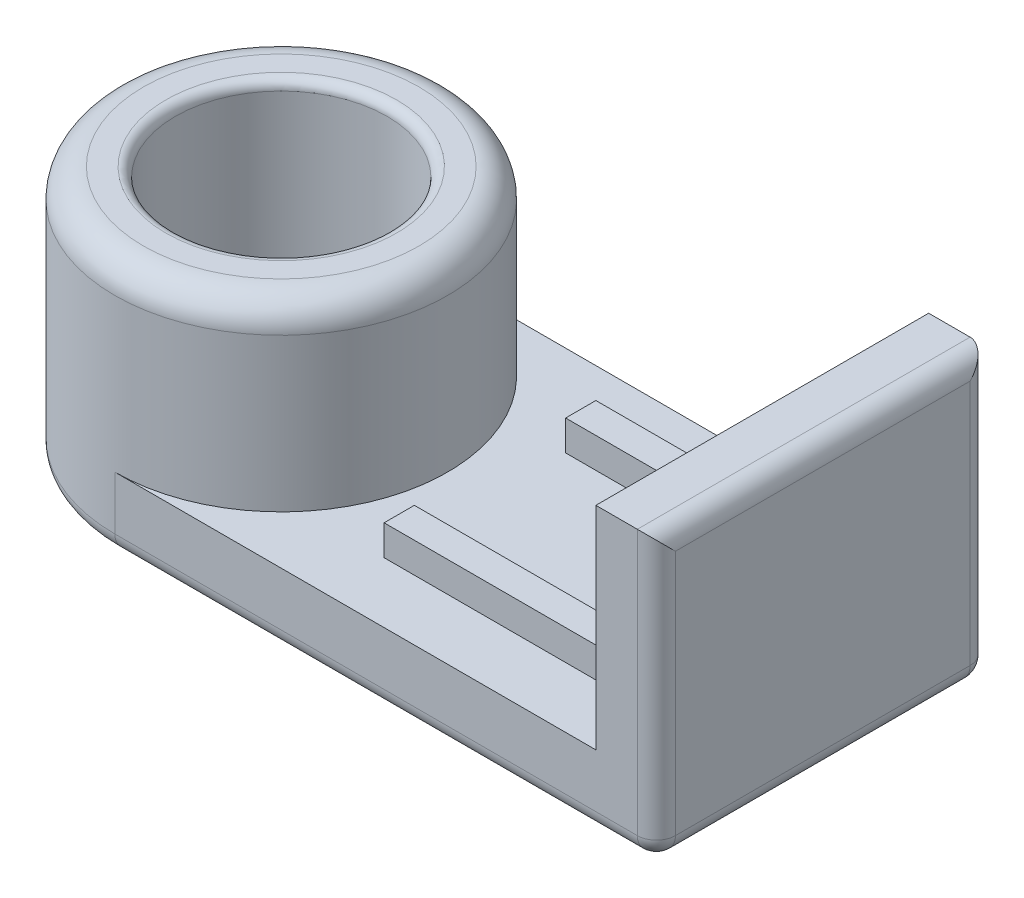
from build123d import *

# Parameters (mm, degrees)
BOSS_EXTRUDE1_DEPTH = 7.62
SKETCH4_W           = 6.35
SKETCH4_H           = 34.925
BOSS_EXTRUDE3_DEPTH = 12.7
SKETCH5_R           = 11.1125
CUT_EXTRUDE1_DEPTH  = 12.7
SKETCH6_W           = 25.4
SKETCH6_H           = 3.175
BOSS_EXTRUDE4_DEPTH = 3.175
SKETCH7_W           = 25.4
SKETCH7_H           = 3.175
BOSS_EXTRUDE5_DEPTH = 3.175
SKETCH10_W          = 6.35
SKETCH10_H          = 34.925
BOSS_EXTRUDE8_DEPTH = 9.525
FILLET1_R           = 2
FILLET2_R           = 2
SKETCH11_R          = 17.4625
BOSS_EXTRUDE9_DEPTH = 19.05
SKETCH12_R          = 11.1125
CUT_EXTRUDE2_DEPTH  = 47.677899348
FILLET3_R           = 1
FILLET4_R           = 3


with BuildPart() as part:
    # Sketch1 → Boss-Extrude1 (new body)
    with BuildSketch(Plane(origin=(0, 0, 0), x_dir=(1, 0, 0), z_dir=(0, 1, 0))):
        with BuildLine():
            Line((37.1475, -17.4625), (37.1475, 17.4625))
            Line((37.1475, 17.4625), (-19.685, 17.4625))
            ThreePointArc((-19.685, 17.4625), (-37.1475, 0), (-19.685, -17.4625))
            Line((-19.685, -17.4625), (37.1475, -17.4625))
        make_face()
    extrude(amount=BOSS_EXTRUDE1_DEPTH)

    # Sketch4 → Boss-Extrude3 (add)
    with BuildSketch(Plane(origin=(0, 7.62, 0), x_dir=(1, 0, 0), z_dir=(0, 1, 0))):
        with Locations((33.9725, 0)):
            Rectangle(SKETCH4_W, SKETCH4_H)
    extrude(amount=BOSS_EXTRUDE3_DEPTH)

    # Sketch5 → Cut-Extrude1 (cut)
    with BuildSketch(Plane(origin=(0, 7.62, 0), x_dir=(1, 0, 0), z_dir=(0, 1, 0))):
        with Locations(Location((-19.685, 0, 0), (0, 0, 270))):
            Circle(SKETCH5_R)
    extrude(amount=-CUT_EXTRUDE1_DEPTH, mode=Mode.SUBTRACT)

    # Sketch6 → Boss-Extrude4 (add)
    with BuildSketch(Plane(origin=(0, 7.62, 0), x_dir=(1, 0, 0), z_dir=(0, 1, 0))):
        with Locations((14.9225, 9.525)):
            Rectangle(SKETCH6_W, SKETCH6_H)
    extrude(amount=BOSS_EXTRUDE4_DEPTH)

    # Sketch7 → Boss-Extrude5 (add)
    with BuildSketch(Plane(origin=(0, 7.62, 0), x_dir=(1, 0, 0), z_dir=(0, 1, 0))):
        with Locations((14.9225, -9.525)):
            Rectangle(SKETCH7_W, SKETCH7_H)
    extrude(amount=BOSS_EXTRUDE5_DEPTH)

    # Sketch10 → Boss-Extrude8 (add)
    with BuildSketch(Plane(origin=(0, 20.32, 0), x_dir=(1, 0, 0), z_dir=(0, 1, 0))):
        with Locations((33.9725, 0)):
            Rectangle(SKETCH10_W, SKETCH10_H)
    extrude(amount=BOSS_EXTRUDE8_DEPTH)

    # Fillet1
    fillet1_edges = [part.edges().sort_by_distance(p)[0] for p in [
        (37.1475, 29.845, 0),
        (37.1475, 14.9225, -17.4625),
        (37.1475, 14.9225, 17.4625),
    ]]
    fillet(fillet1_edges, radius=FILLET1_R)

    # Fillet2
    fillet2_edges = [part.edges().sort_by_distance(p)[0] for p in [
        (-37.1475, 0, 0),
        (7.73125, 0, 17.4625),
        (37.1475, 0, 0),
        (7.73125, 0, -17.4625),
        (36.561713562, 0, -16.876713562),
        (36.561713562, 0, 16.876713562),
    ]]
    fillet(fillet2_edges, radius=FILLET2_R)

    # Sketch11 → Boss-Extrude9 (add)
    with BuildSketch(Plane(origin=(0, 7.62, 0), x_dir=(1, 0, 0), z_dir=(0, 1, 0))):
        with Locations(Location((-19.685, 0, 0), (0, 0, 270))):
            Circle(SKETCH11_R)
    extrude(amount=BOSS_EXTRUDE9_DEPTH)

    # Sketch12 → Cut-Extrude2 (cut, through all)
    with BuildSketch(Plane(origin=(0, 7.62, 0), x_dir=(-1, 0, 0), z_dir=(0, -1, 0))):
        with Locations(Location((19.685, 0, 0), (0, 0, 270))):
            Circle(SKETCH12_R)
    extrude(amount=-CUT_EXTRUDE2_DEPTH, mode=Mode.SUBTRACT)

    # Fillet3
    fillet3_edges = [part.edges().sort_by_distance(p)[0] for p in [
        (-19.685, 26.67, -11.1125),
        (-19.685, 0, -11.1125),
    ]]
    fillet(fillet3_edges, radius=FILLET3_R)

    # Fillet4
    fillet4_edges = [part.edges().sort_by_distance(p)[0] for p in [
        (-19.685, 26.67, -17.4625),
    ]]
    fillet(fillet4_edges, radius=FILLET4_R)


solid = part.part
